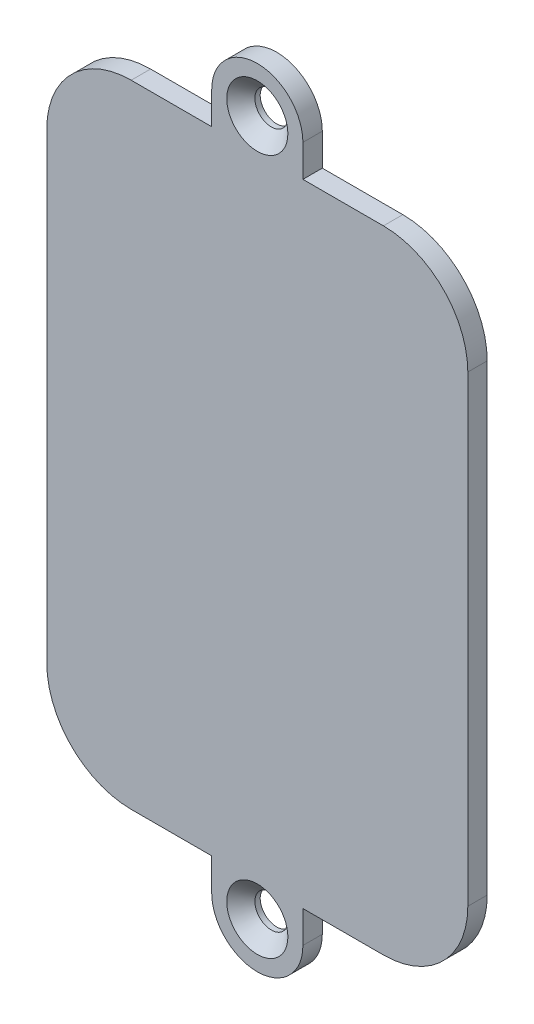
from build123d import *

# Parameters (mm, degrees)
BOSS_EXTRU_1_DEPTH                          = 2
FRAISAGE_POUR_VIS_T_TE_FRAIS_E_M31_AT_COUNT = 2
FRAISAGE_POUR_VIS_T_TE_FRAIS_E_M31_AT_PITCH = 71.69


with BuildPart() as part:
    # Esquisse1 → Boss.-Extru.1 (new body)
    with BuildSketch(Plane.XY):
        with BuildLine():
            Line((-4.7, 69.04), (-4.7, 65.74))
            Line((-4.7, 65.74), (-13, 65.74))
            ThreePointArc((-13, 65.74), (-19.151828996, 63.191828996), (-21.7, 57.04))
            Line((-21.7, 57.04), (-21.7, 9.35))
            ThreePointArc((-21.7, 9.35), (-19.151828996, 3.198171004), (-13, 0.65))
            Line((-13, 0.65), (-4.7, 0.65))
            Line((-4.7, 0.65), (-4.7, -2.65))
            ThreePointArc((-4.7, -2.65), (0, -7.35), (4.7, -2.65))
            Line((4.7, -2.65), (4.7, 0.65))
            Line((4.7, 0.65), (13, 0.65))
            ThreePointArc((13, 0.65), (19.151828996, 3.198171004), (21.7, 9.35))
            Line((21.7, 9.35), (21.7, 57.04))
            ThreePointArc((21.7, 57.04), (19.151828996, 63.191828996), (13, 65.74))
            Line((13, 65.74), (4.7, 65.74))
            Line((4.7, 65.74), (4.7, 69.04))
            ThreePointArc((4.7, 69.04), (0, 73.74), (-4.7, 69.04))
        make_face()
    extrude(amount=BOSS_EXTRU_1_DEPTH)

    # Esquisse4 → Fraisage pour vis à tête fraisée M31 (revolve, cut)
    with BuildSketch(Plane(origin=(0, 69.04, 2), x_dir=(0, -1, 0), z_dir=(1, 0, 0))):
        Polygon((0, 0), (0, 2), (1.7, 2), (1.7, 1.45), (3.15, 0), align=None)
    fraisage_pour_vis_t_te_frais_e_m31 = revolve(axis=Axis((0, 69.04, 8.35), (0, 0, -1)), mode=Mode.SUBTRACT)

    # Fraisage pour vis à tête fraisée M31 at: Fraisage pour vis à tête fraisée M31 ×2
    with Locations(*[(0, -i * FRAISAGE_POUR_VIS_T_TE_FRAIS_E_M31_AT_PITCH, 0) for i in range(1, FRAISAGE_POUR_VIS_T_TE_FRAIS_E_M31_AT_COUNT)]):
        add(fraisage_pour_vis_t_te_frais_e_m31, mode=Mode.SUBTRACT)


solid = part.part
